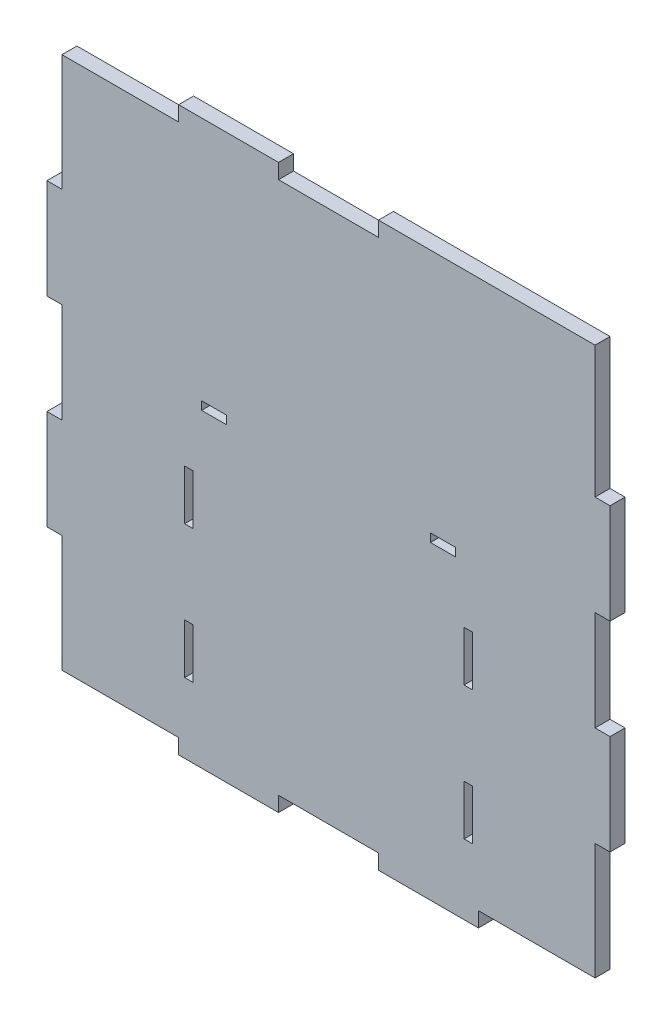
from build123d import *

# Parameters (mm, degrees)
BOSS_EXTRUDE1_DEPTH = 9
SKETCH5_W           = 5
SKETCH5_H           = 30
SKETCH5_W_2         = 15
SKETCH5_H_2         = 5
CUT_EXTRUDE2_DEPTH  = 9


with BuildPart() as part:
    # Sketch2 → Boss-Extrude1 (new body)
    with BuildSketch(Plane.XY):
        Polygon((-151.004642906, 60), (-160.004642906, 60), (-160.004642906, 0), (-151.004642906, 0), (-151.004642906, -60), (-160.004642906, -60), (-160.004642906, -120), (-151.004642906, -120), (-151.004642906, -190), (-81.004642906, -190), (-81.004642906, -199), (-21.004642906, -199), (-21.004642906, -190), (38.995357094, -190), (38.995357094, -199), (98.995357094, -199), (98.995357094, -190), (168.995357094, -190), (168.995357094, -120), (177.995357094, -120), (177.995357094, -60), (168.995357094, -60), (168.995357094, 0), (177.995357094, 0), (177.995357094, 60), (168.995357094, 60), (168.995357094, 130), (168.995357094, 139), (98.995357094, 139), (38.995357094, 139), (38.995357094, 130), (-21.004642906, 130), (-21.004642906, 139), (-81.004642906, 139), (-81.004642906, 130), (-151.004642906, 130), align=None)
    extrude(amount=BOSS_EXTRUDE1_DEPTH)

    # Sketch5 → Cut-Extrude2 (cut)
    with BuildSketch(Plane.XY.offset(9)):
        with Locations((92.864342421, -142)):
            Rectangle(SKETCH5_W, SKETCH5_H)
        with Locations((-59.699642906, -10.5)):
            Rectangle(SKETCH5_W_2, SKETCH5_H_2)
        with Locations((-74.873628233, -62)):
            Rectangle(SKETCH5_W, SKETCH5_H)
        with Locations((-74.873628233, -142)):
            Rectangle(SKETCH5_W, SKETCH5_H)
        with Locations((92.864342421, -62)):
            Rectangle(SKETCH5_W, SKETCH5_H)
        with Locations((77.690357094, -10.5)):
            Rectangle(SKETCH5_W_2, SKETCH5_H_2)
    extrude(amount=-CUT_EXTRUDE2_DEPTH, mode=Mode.SUBTRACT)


solid = part.part
